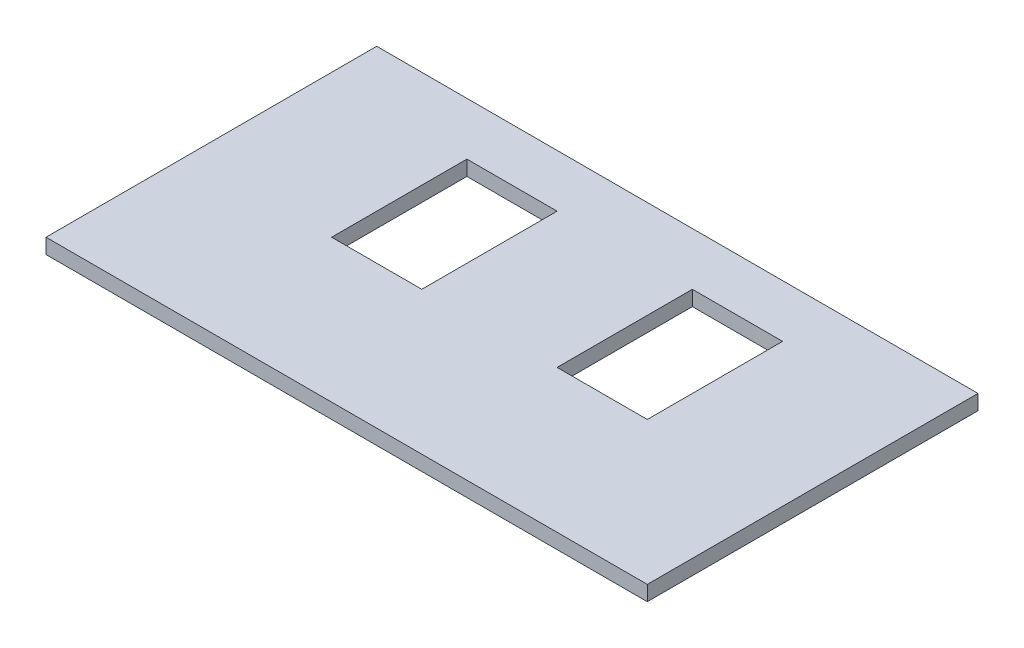
from build123d import *

# Parameters (mm, degrees)
SKETCH_1_W      = 200
SKETCH_1_H      = 110
SKETCH_1_W_2    = 30
SKETCH_1_H_2    = 45
EXTRUDE_1_DEPTH = 5


with BuildPart() as part:
    # 草图1 → 凸台-拉伸1 (new body)
    with BuildSketch(Plane(origin=(0, 0, 0), x_dir=(1, 0, 0), z_dir=(0, 1, 0))):
        with Locations((100, 55)):
            Rectangle(SKETCH_1_W, SKETCH_1_H)
        with Locations((62.5, 70)):
            Rectangle(SKETCH_1_W_2, SKETCH_1_H_2, mode=Mode.SUBTRACT)
        with Locations((137.5, 70)):
            Rectangle(SKETCH_1_W_2, SKETCH_1_H_2, mode=Mode.SUBTRACT)
    extrude(amount=EXTRUDE_1_DEPTH)


solid = part.part
